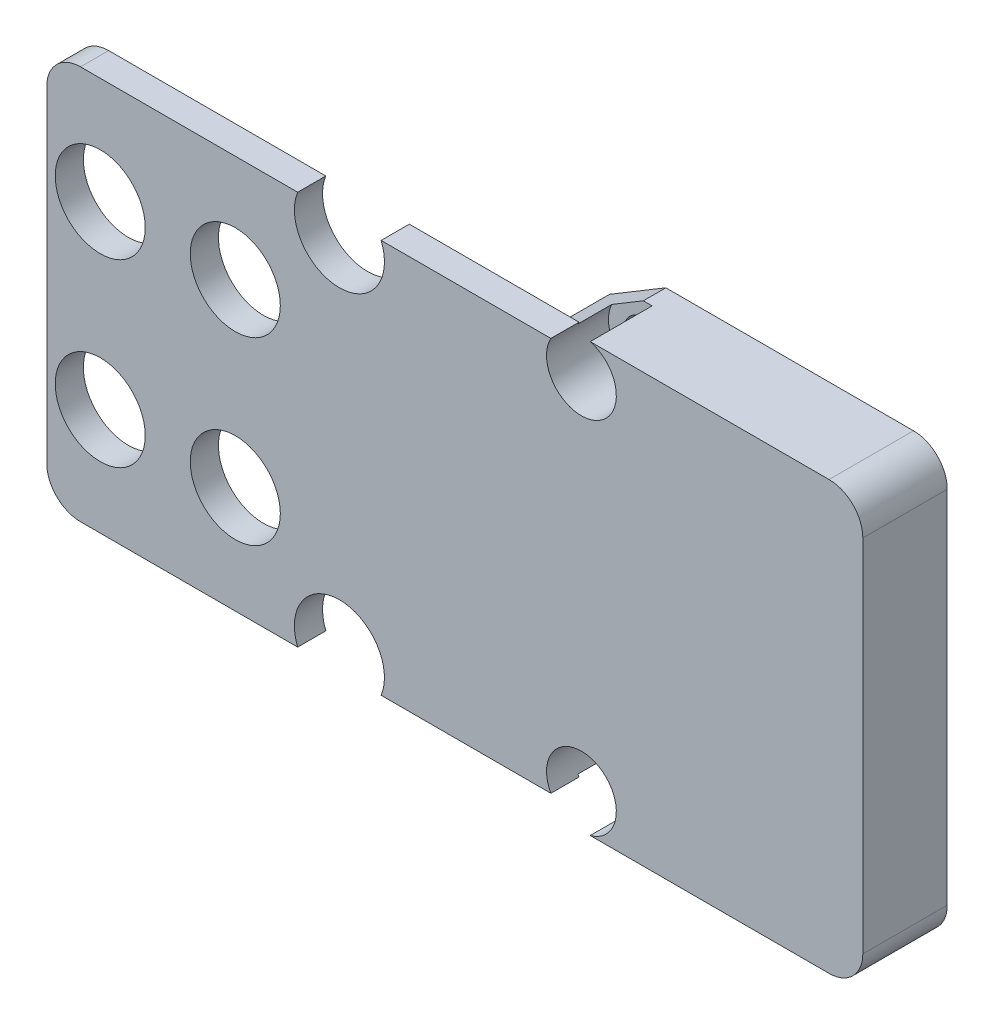
from build123d import *

# Parameters (mm, degrees)
CROQUIS1_R              = 1.707370132
SALIENTE_EXTRUIR1_DEPTH = 7.5
SALIENTE_EXTRUIR2_DEPTH = 2.5
CROQUIS5_R              = 4
CROQUIS5_R_2            = 3.5
CORTAR_EXTRUIR1_DEPTH   = 2.5
REDONDEO1_R             = 3
CROQUIS6_R              = 3.1
CORTAR_EXTRUIR2_DEPTH   = 5.5


with BuildPart() as part:
    # Croquis1 → Saliente-Extruir1 (new body)
    with BuildSketch(Plane.XY):
        Polygon((-69.586479396, 30.699597615), (-44.586479396, 30.699597615), (-44.586479396, -7.300402385), (-69.586479396, -7.300402385), (-74.586479396, -4.300402385), (-74.586479396, 27.699597615), align=None)
        with Locations((-69.586479396, 27.699597615)):
            Circle(CROQUIS1_R, mode=Mode.SUBTRACT)
        with Locations((-69.586479396, -4.300402385)):
            Circle(CROQUIS1_R, mode=Mode.SUBTRACT)
    extrude(amount=SALIENTE_EXTRUIR1_DEPTH)

    # Croquis4 → Saliente-Extruir2 (add)
    with BuildSketch(Plane.XY.offset(7.5)):
        Polygon((-72.086479396, 29.199597615), (-117.086479396, 29.199597615), (-117.086479396, -5.800402385), (-72.086479396, -5.800402385), (-74.586479396, -4.300402385), (-74.586479396, 27.699597615), align=None)
    extrude(amount=-SALIENTE_EXTRUIR2_DEPTH)

    # Croquis5 → Cortar-Extruir1 (cut)
    with BuildSketch(Plane.XY.offset(7.5)):
        with Locations((-91.086479396, -4.300402385)):
            Circle(CROQUIS5_R)
        with Locations((-91.086479396, 27.699597615)):
            Circle(CROQUIS5_R)
        with Locations((-121.586479396, -4.300402385)):
            Circle(CROQUIS5_R_2)
        with Locations((-121.586479396, 27.699597615)):
            Circle(CROQUIS5_R_2)
        with Locations((-100.336479396, 19.699597615)):
            Circle(CROQUIS5_R)
        with Locations((-112.336479396, 19.699597615)):
            Circle(CROQUIS5_R)
        with Locations((-112.336479396, 3.699597615)):
            Circle(CROQUIS5_R)
        with Locations((-100.336479396, 3.699597615)):
            Circle(CROQUIS5_R)
    extrude(amount=-CORTAR_EXTRUIR1_DEPTH, mode=Mode.SUBTRACT)

    # Redondeo1
    redondeo1_edges = [part.edges().sort_by_distance(p)[0] for p in [
        (-44.586479396, 30.699597615, 3.75),
        (-44.586479396, -7.300402385, 3.75),
        (-117.086479396, -5.800402385, 6.25),
        (-117.086479396, 29.199597615, 6.25),
    ]]
    fillet(redondeo1_edges, radius=REDONDEO1_R)

    # Croquis6 → Cortar-Extruir2 (cut)
    with BuildSketch(Plane.XY.offset(7.5)):
        with Locations((-69.586479396, 27.699597615)):
            Circle(CROQUIS6_R)
        with Locations((-69.586479396, -4.300402385)):
            Circle(CROQUIS6_R)
    extrude(amount=-CORTAR_EXTRUIR2_DEPTH, mode=Mode.SUBTRACT)


solid = part.part
